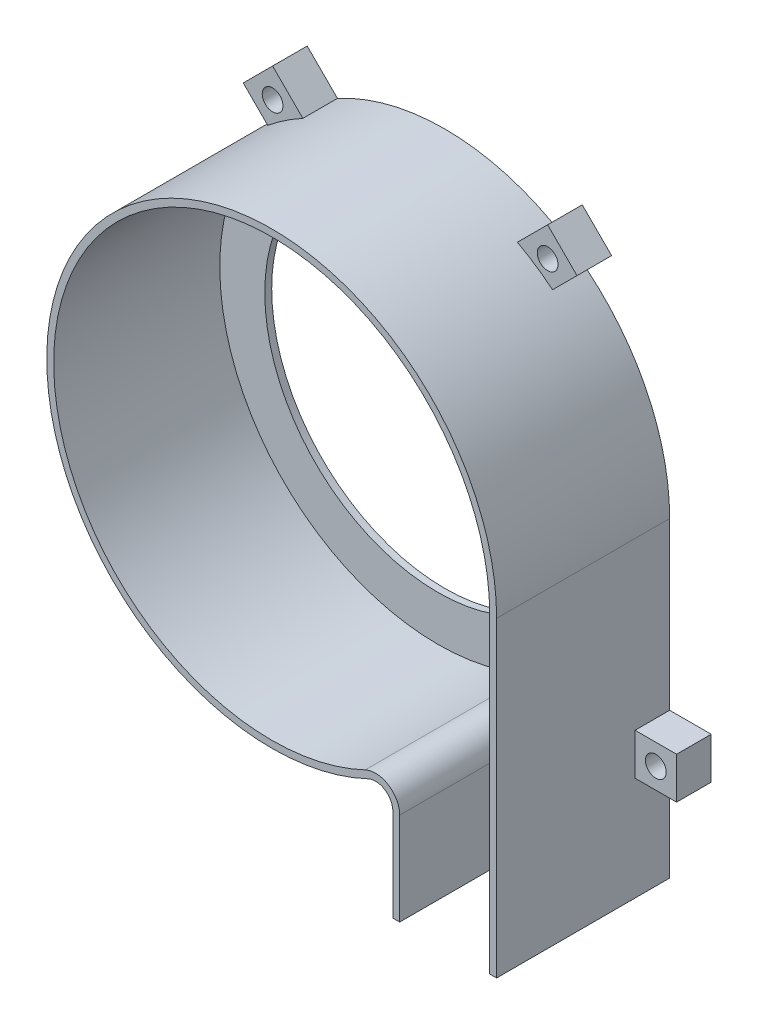
from build123d import *

# Parameters (mm, degrees)
ESQUISSE1_R             = 25
BOSS_EXTRU_1_DEPTH      = 30
COQUE1_T                = -1
ENL_V_START             = -5
ENL_V_MAT_EXTRU_1_DEPTH = 5
ESQUISSE4_W             = 6
ESQUISSE4_H             = 6
ESQUISSE4_R             = 1.5
BOSS_EXTRU_3_DEPTH      = 5


with BuildPart() as part:
    # Esquisse1 → Boss.-Extru.1 (new body)
    with BuildSketch(Plane.XY):
        with BuildLine():
            Line((32.5, 0), (32.5, -45))
            Line((32.5, -45), (17.5, -45))
            Line((17.5, -45), (17.5, -31.622776602))
            ThreePointArc((17.5, -31.622776602), (16.33630621, -29.509890965), (13.928571429, -29.364006844))
            ThreePointArc((13.928571429, -29.364006844), (-27.467513279, 17.371980724), (32.5, 0))
        make_face()
        Circle(ESQUISSE1_R, mode=Mode.SUBTRACT)
    extrude(amount=BOSS_EXTRU_1_DEPTH)

    # Coque1
    coque1_openings = [part.faces().sort_by_distance(p)[0] for p in [
        (25, -45, 15),
        (-25, 0, 15),
    ]]
    offset(amount=COQUE1_T, openings=coque1_openings, kind=Kind.INTERSECTION)

    # Esquisse2 → Enlèv. mat.-Extru.1 (cut)
    with BuildSketch(Plane.XY.offset(30).offset(ENL_V_START)):
        with BuildLine():
            Line((17.5, -31.622776602), (17.5, -45))
            Line((17.5, -45), (32.5, -45))
            Line((32.5, -45), (32.5, 0))
            ThreePointArc((32.5, 0), (-27.467513279, 17.371980724), (13.928571429, -29.364006844))
            ThreePointArc((13.928571429, -29.364006844), (16.33630621, -29.509890965), (17.5, -31.622776602))
        make_face()
    extrude(amount=ENL_V_MAT_EXTRU_1_DEPTH, mode=Mode.SUBTRACT)

    # Esquisse4 → Boss.-Extru.3 (add)
    # profile 1 of 3: a face of its own
    with BuildSketch(Plane(origin=(0, 0, 0), x_dir=(-1, 0, 0), z_dir=(0, 0, -1))):
        with Locations((-35.5, -27)):
            Rectangle(ESQUISSE4_W, ESQUISSE4_H)
        with Locations((-35.5, -27)):
            Circle(ESQUISSE4_R, mode=Mode.SUBTRACT)
    # profile 2 of 3: a face of its own
    with BuildSketch(Plane(origin=(0, 0, 0), x_dir=(-1, 0, 0), z_dir=(0, 0, -1))):
        with BuildLine():
            Line((-24.112106084, 28.692136963), (-20.576572178, 25.156603057))
            ThreePointArc((-20.576572178, 25.156603057), (-18.118767277, 26.980738914), (-15.500260247, 28.5655725))
            Line((-15.500260247, 28.5655725), (-19.869465397, 32.93477765))
            Line((-19.869465397, 32.93477765), (-24.112106084, 28.692136963))
        make_face()
        with Locations((-19.869465397, 28.692136963)):
            Circle(ESQUISSE4_R, mode=Mode.SUBTRACT)
    # profile 3 of 3: a face of its own
    with BuildSketch(Plane(origin=(0, 0, 0), x_dir=(-1, 0, 0), z_dir=(0, 0, -1))):
        with BuildLine():
            Line((19.869465397, 32.93477765), (15.500260247, 28.5655725))
            ThreePointArc((15.500260247, 28.5655725), (18.118767277, 26.980738914), (20.576572178, 25.156603057))
            Line((20.576572178, 25.156603057), (24.112106084, 28.692136963))
            Line((24.112106084, 28.692136963), (19.869465397, 32.93477765))
        make_face()
        with Locations((19.869465397, 28.692136963)):
            Circle(ESQUISSE4_R, mode=Mode.SUBTRACT)
    extrude(amount=-BOSS_EXTRU_3_DEPTH)


solid = part.part
